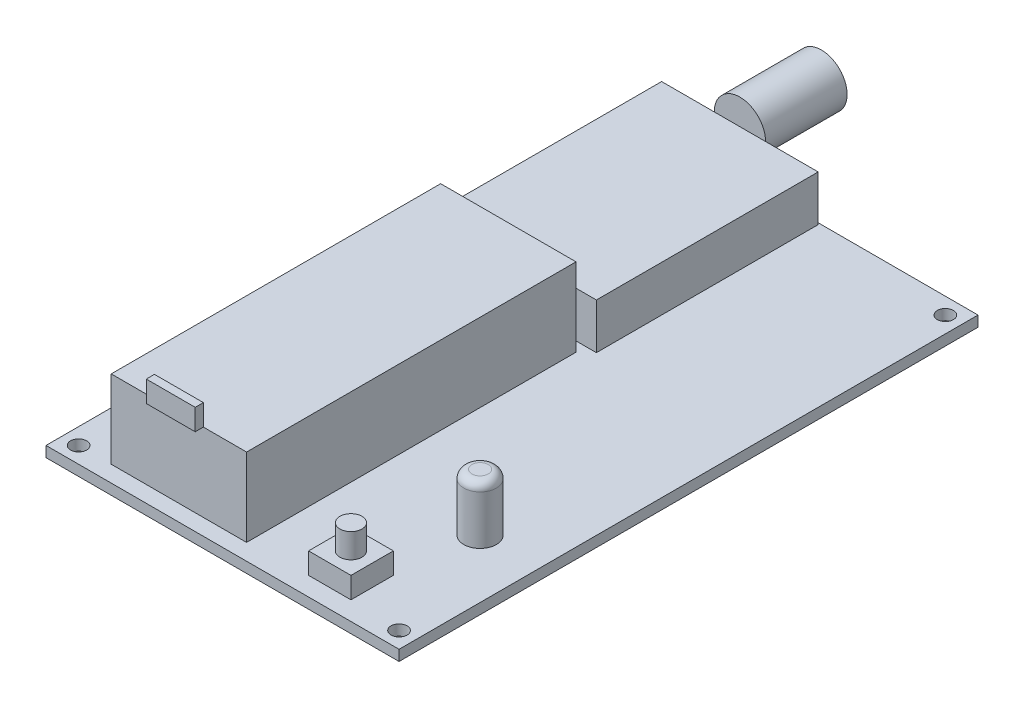
from build123d import *

# Parameters (mm, degrees)
SKETCH1_W           = 54.991
SKETCH1_H           = 90.17
BOARD_DEPTH         = 1.651
SKETCH2_W           = 21.082
SKETCH2_H           = 51.308
RPI_DEPTH           = 12.192
SKETCH2_3_W         = 6.604
SKETCH2_3_H         = 6.604
BUTTON_BASE_DEPTH   = 3.302
SKETCH2_4_W         = 24.384
SKETCH2_4_H         = 34.544
ZIGBEE_DEPTH        = 7.112
SKETCH3_R           = 1.7145
BUTTON_DEPTH        = 3.81
SKETCH4_R           = 2.54
LED_DEPTH           = 8.89
FILLET1_R           = 1.27
SKETCH5_W           = 7.62
SKETCH5_H           = 3.302
PI_PLUG_DEPTH       = 1.27
SKETCH6_R           = 4.0005
BOSS_EXTRUDE8_DEPTH = 12.7
SKETCH7_R           = 1.25
SCREW_HOLES_DEPTH   = 118.448361304


with BuildPart() as part:
    # Sketch1 → Board (new body)
    with BuildSketch(Plane(origin=(0, 0, 0), x_dir=(1, 0, 0), z_dir=(0, 1, 0))):
        with Locations((27.4955, 45.085)):
            Rectangle(SKETCH1_W, SKETCH1_H)
    extrude(amount=BOARD_DEPTH)

    # Sketch2 → RPI (add)
    with BuildSketch(Plane(origin=(0, 1.651, 0), x_dir=(1, 0, 0), z_dir=(0, 1, 0))):
        with Locations((18.161, 28.194)):
            Rectangle(SKETCH2_W, SKETCH2_H)
    extrude(amount=RPI_DEPTH)

    # Sketch2<3> → Button Base (add)
    with BuildSketch(Plane(origin=(0, 1.651, 0), x_dir=(1, 0, 0), z_dir=(0, 1, 0))):
        with Locations((41.275, 6.223)):
            Rectangle(SKETCH2_3_W, SKETCH2_3_H)
    extrude(amount=BUTTON_BASE_DEPTH)

    # Sketch2<4> → Zigbee (add)
    with BuildSketch(Plane(origin=(0, 1.651, 0), x_dir=(1, 0, 0), z_dir=(0, 1, 0))):
        with Locations((18.161, 72.644)):
            Rectangle(SKETCH2_4_W, SKETCH2_4_H)
    extrude(amount=ZIGBEE_DEPTH)

    # Sketch3 → Button (add)
    with BuildSketch(Plane(origin=(0, 4.953, 0), x_dir=(1, 0, 0), z_dir=(0, 1, 0))):
        with Locations((41.275, 6.223)):
            Circle(SKETCH3_R)
    extrude(amount=BUTTON_DEPTH)

    # Sketch4 → LED (add)
    with BuildSketch(Plane(origin=(0, 1.651, 0), x_dir=(1, 0, 0), z_dir=(0, 1, 0))):
        with Locations((45.908383197, 21.701767965)):
            Circle(SKETCH4_R)
    extrude(amount=LED_DEPTH)

    # Fillet1
    fillet1_edges = [part.edges().sort_by_distance(p)[0] for p in [
        (43.368383197, 10.541, -21.701767965),
    ]]
    fillet(fillet1_edges, radius=FILLET1_R)

    # Sketch6 → Boss-Extrude8 (add)
    with BuildSketch(Plane(origin=(0, 0, -89.916), x_dir=(-1, 0, 0), z_dir=(0, 0, -1))):
        with Locations((-18.161, 8.763)):
            Circle(SKETCH6_R)
    extrude(amount=BOSS_EXTRUDE8_DEPTH)

    # Sketch7 → Screw Holes (cut, through all)
    with BuildSketch(Plane(origin=(0, 1.651, 0), x_dir=(1, 0, 0), z_dir=(0, 1, 0))):
        with Locations((2.54, 87.63)):
            Circle(SKETCH7_R)
        with Locations((2.54, 2.54)):
            Circle(SKETCH7_R)
        with Locations((52.451, 2.54)):
            Circle(SKETCH7_R)
        with Locations((52.451, 87.63)):
            Circle(SKETCH7_R)
    extrude(amount=-SCREW_HOLES_DEPTH, mode=Mode.SUBTRACT)


with BuildPart() as body_2:
    # Sketch5 → PI Plug (new body)
    with BuildSketch(Plane.XY.offset(-2.54)):
        with Locations((18.161, 15.494)):
            Rectangle(SKETCH5_W, SKETCH5_H)
    extrude(amount=PI_PLUG_DEPTH)


solid = Compound([part.part, body_2.part])
